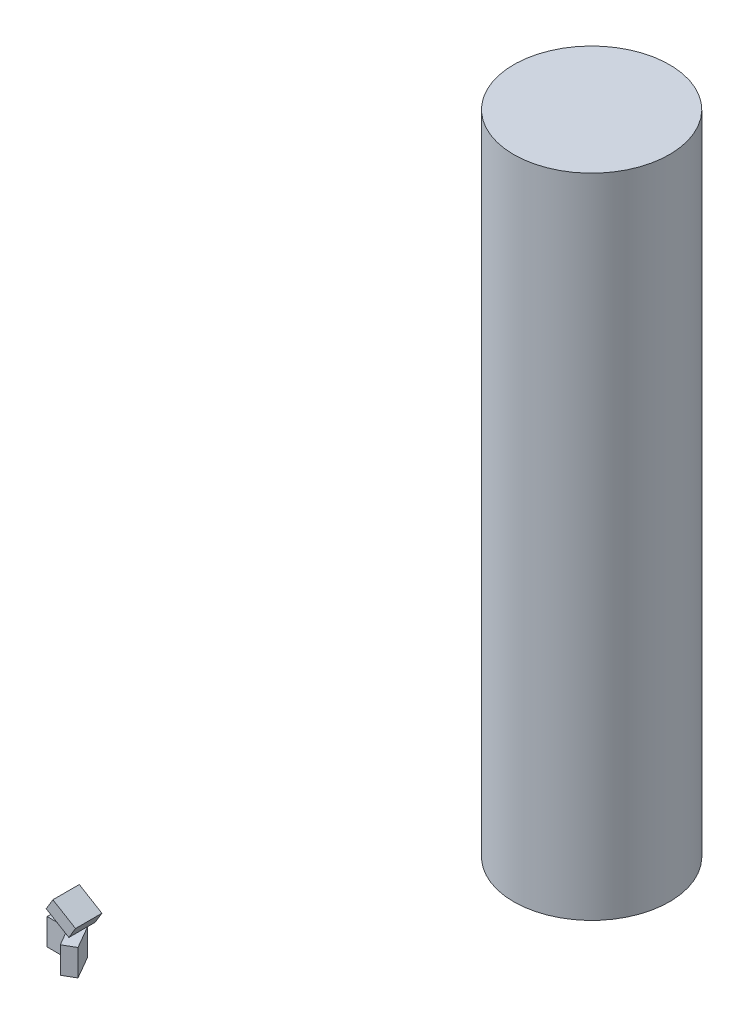
from build123d import *

# Parameters (mm, degrees)
CROQUIS4_R              = 60.187347707
SALIENTE_EXTRUIR1_DEPTH = 500
CROQUIS5_W              = 20.4
CROQUIS5_H              = 10
SALIENTE_EXTRUIR2_DEPTH = 10.2
CROQUIS8_W              = 20.4
CROQUIS8_H              = 10
SALIENTE_EXTRUIR4_DEPTH = 10.2


with BuildPart() as part:
    # Croquis4 → Saliente-Extruir1 (new body)
    with BuildSketch(Plane(origin=(0, 0, 0), x_dir=(1, 0, 0), z_dir=(0, 1, 0))):
        with Locations(Location((0, 10.648786568, 0), (0, 0, 270))):
            Circle(CROQUIS4_R)
    extrude(amount=SALIENTE_EXTRUIR1_DEPTH)


with BuildPart() as body_2:
    # Croquis5 → Saliente-Extruir2 (new, symmetric)
    with BuildSketch(Plane(origin=(0, 0, 0), x_dir=(1, 0, 0), z_dir=(0, 1, 0))):
        with Locations((-150, -244.807621135)):
            Rectangle(CROQUIS5_W, CROQUIS5_H)
    saliente_extruir2 = extrude(amount=SALIENTE_EXTRUIR2_DEPTH, both=True)

    # Simetría5: Saliente-Extruir2 across plane
    add(saliente_extruir2.mirror(Plane(origin=(0, 0, 0), x_dir=(-0.49999999999999983, 0, 0.8660254037844387), z_dir=(0.8660254037844386, 0, 0.4999999999999999))))


with BuildPart() as body_3:
    # Croquis8 → Saliente-Extruir4 (new, symmetric)
    with BuildSketch(Plane(origin=(-110.294117647, 66.176470588, 0), x_dir=(0, 0, 1), z_dir=(-0.8574929257125441, 0.5144957554275266, 0))):
        with Locations((259.807621135, -37.174363314)):
            Rectangle(CROQUIS8_W, CROQUIS8_H)
    extrude(amount=SALIENTE_EXTRUIR4_DEPTH, both=True)


solid = Compound([part.part, body_2.part, body_3.part])
